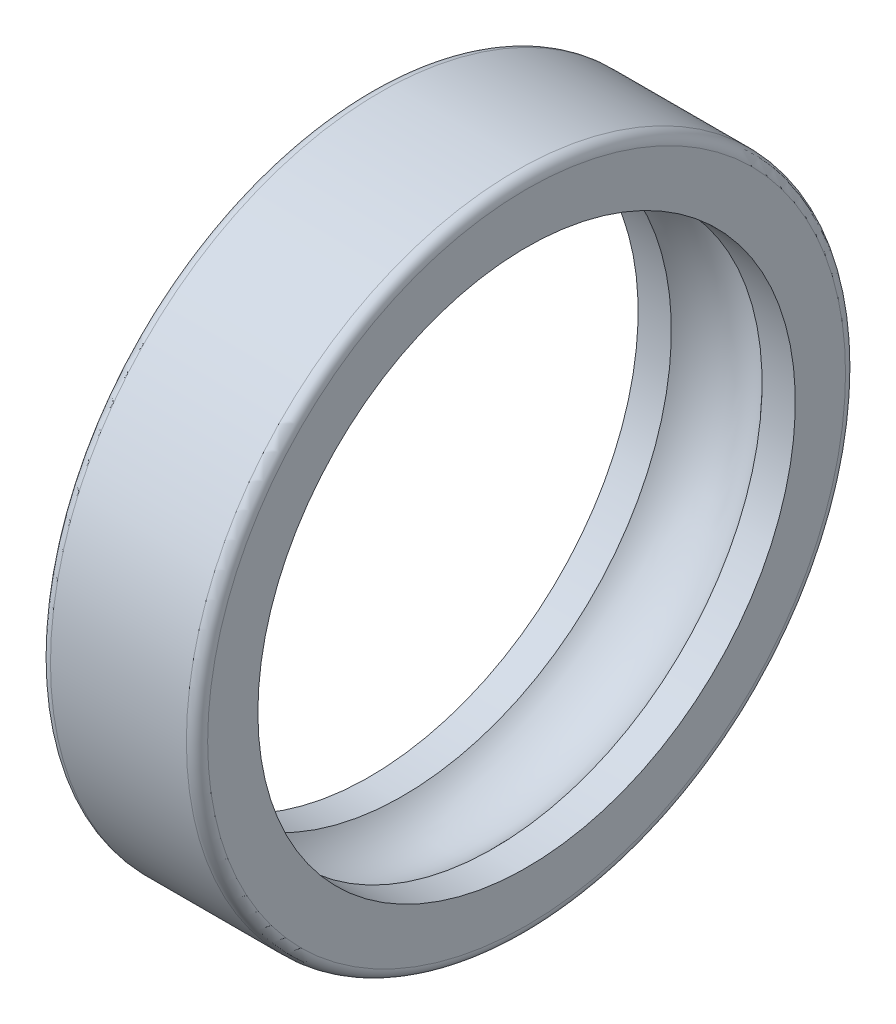
from build123d import *

# Parameters (mm, degrees)
FILLET1_R = 2.1


with BuildPart() as part:
    # Sketch1 → Revolve1 (revolve)
    with BuildSketch(Plane(origin=(0, 0, 0), x_dir=(1, 0, 0), z_dir=(0, 1, 0)), mode=Mode.PRIVATE) as revolve1_sk:
        with BuildLine():
            Line((15.5, 65), (-15.5, 65))
            Line((-15.5, 65), (-15.5, 53))
            Line((-15.5, 53), (-8.94427191, 53))
            ThreePointArc((-8.94427191, 53), (0, 57), (8.94427191, 53))
            Line((8.94427191, 53), (15.5, 53))
            Line((15.5, 53), (15.5, 65))
        make_face()
    revolve(revolve1_sk.sketch.rotate(Axis((-67.731092437, 0, 0), (1, 0, 0)), 180), axis=Axis((-67.731092437, 0, 0), (1, 0, 0)))

    # Fillet1
    fillet1_edges = [part.edges().sort_by_distance(p)[0] for p in [
        (15.5, 0, -65),
        (-15.5, 0, -65),
    ]]
    fillet(fillet1_edges, radius=FILLET1_R)


solid = part.part
